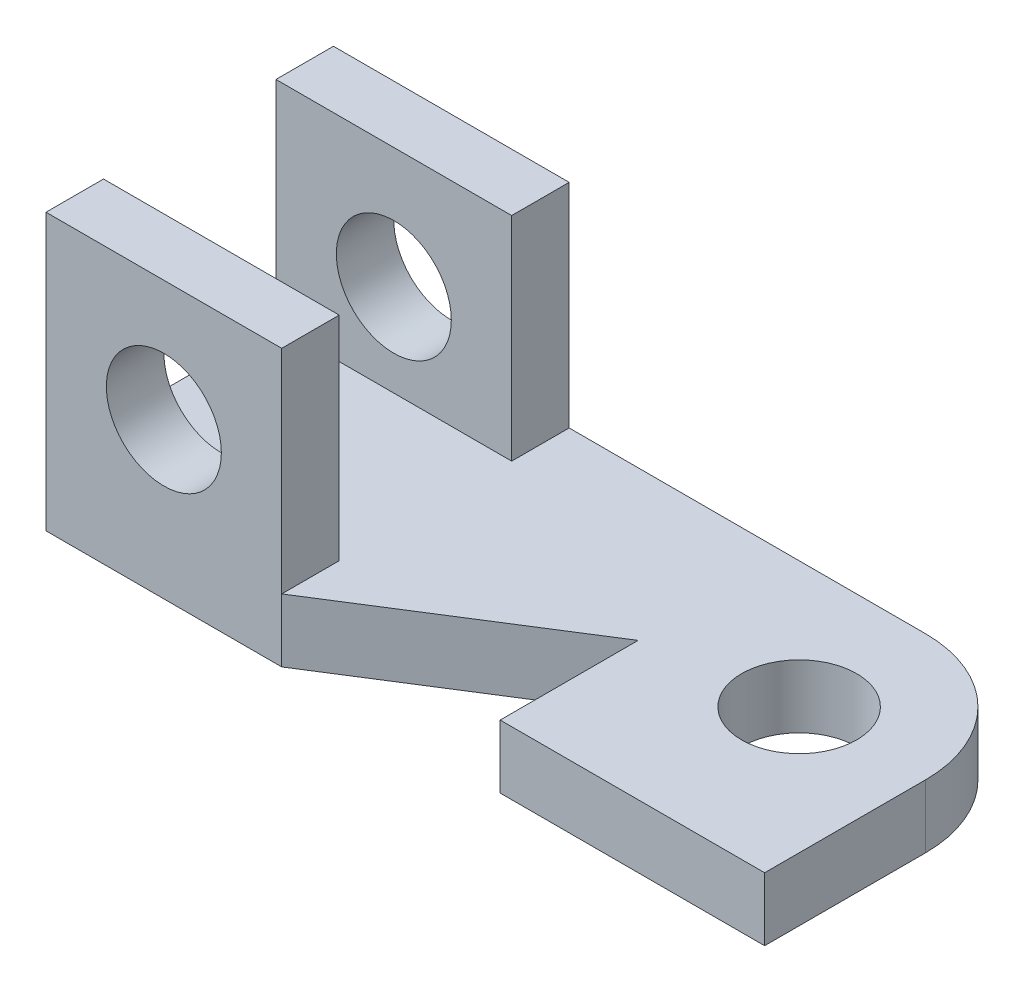
from build123d import *

# Parameters (mm, degrees)
SKETCH1_R           = 254
BOSS_EXTRUDE1_DEPTH = 279.4
SKETCH2_W           = 1041.4
SKETCH2_H           = 254
BOSS_EXTRUDE2_DEPTH = 939.8
SKETCH3_R           = 254
CUT_EXTRUDE1_DEPTH  = 1270


with BuildPart() as part:
    # Sketch1 → Boss-Extrude1 (new body)
    with BuildSketch(Plane(origin=(0, 0, 0), x_dir=(1, 0, 0), z_dir=(0, 1, 0))):
        with BuildLine():
            Line((0, 0), (1041.4, 0))
            Line((1041.4, 0), (2006.6, 609.6))
            Line((2006.6, 609.6), (2006.6, 0))
            Line((2006.6, 0), (3175, 0))
            Line((3175, 0), (3175, 711.2))
            ThreePointArc((3175, 711.2), (3011.331269327, 1106.331269327), (2616.2, 1270))
            Line((2616.2, 1270), (0, 1270))
            Line((0, 1270), (0, 0))
        make_face()
        with Locations(Location((2616.2, 711.2, 0), (0, 0, 270))):
            Circle(SKETCH1_R, mode=Mode.SUBTRACT)
    extrude(amount=BOSS_EXTRUDE1_DEPTH)

    # Sketch2 → Boss-Extrude2 (add)
    with BuildSketch(Plane(origin=(0, 279.4, 0), x_dir=(1, 0, 0), z_dir=(0, 1, 0))):
        with Locations((520.7, 1143)):
            Rectangle(SKETCH2_W, SKETCH2_H)
        with Locations((520.7, 127)):
            Rectangle(SKETCH2_W, SKETCH2_H)
    extrude(amount=BOSS_EXTRUDE2_DEPTH)

    # Sketch3 → Cut-Extrude1 (cut)
    with BuildSketch(Plane.XY):
        with Locations((520.7, 685.8)):
            Circle(SKETCH3_R)
    extrude(amount=-CUT_EXTRUDE1_DEPTH, mode=Mode.SUBTRACT)


solid = part.part
